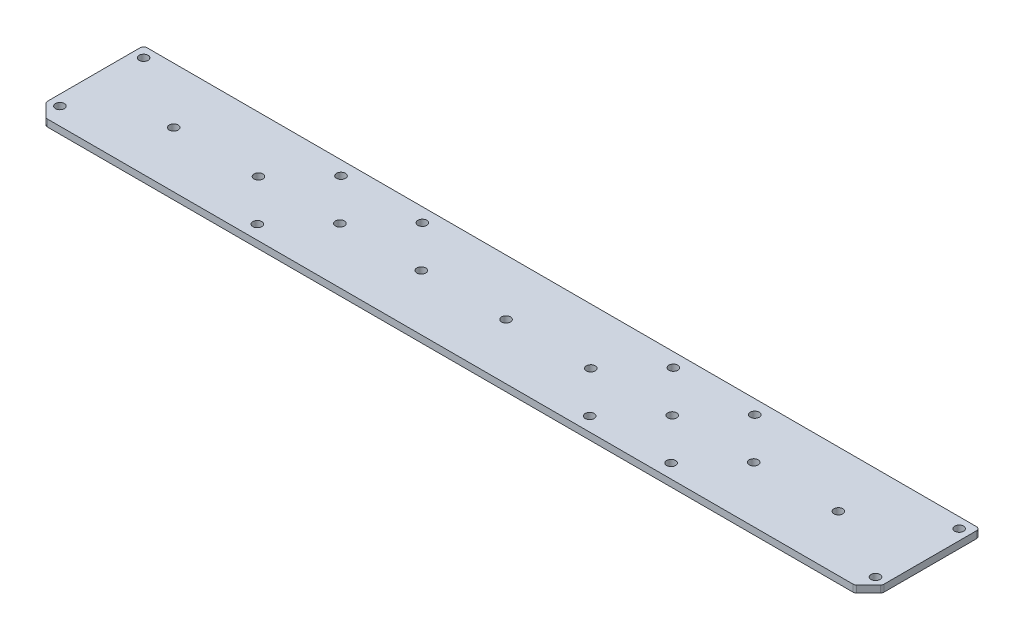
from build123d import *

# Parameters (mm, degrees)
BOSS_EXTRUDE1_DEPTH = 3.175
SKETCH3_R           = 2.032
CUT_EXTRUDE1_DEPTH  = 385.384860036
FILLET1_R           = 1.5875


with BuildPart() as part:
    # Sketch2 → Boss-Extrude1 (new body)
    with BuildSketch(Plane(origin=(0, 0, 0), x_dir=(1, 0, 0), z_dir=(0, 1, 0))):
        with BuildLine():
            Line((0, 7.00756403), (0, 50.8))
            Line((0, 50.8), (381, 50.8))
            Line((381, 50.8), (381, 7.00756403))
            ThreePointArc((381, 7.00756403), (380.879158758, 6.400054081), (380.535032015, 5.885032015))
            Line((380.535032015, 5.885032015), (375.114967985, 0.464967985))
            ThreePointArc((375.114967985, 0.464967985), (374.599945919, 0.120841242), (373.99243597, 0))
            Line((373.99243597, 0), (7.00756403, 0))
            ThreePointArc((7.00756403, 0), (6.400054081, 0.120841242), (5.885032015, 0.464967985))
            Line((5.885032015, 0.464967985), (0.464967985, 5.885032015))
            ThreePointArc((0.464967985, 5.885032015), (0.120841242, 6.400054081), (0, 7.00756403))
        make_face()
    extrude(amount=BOSS_EXTRUDE1_DEPTH)

    # Sketch3 → Cut-Extrude1 (cut, through all)
    with BuildSketch(Plane(origin=(0, 0, 0), x_dir=(1, 0, 0), z_dir=(0, 1, 0))):
        with Locations(Location((4.7625, 7.9375, 0), (0, 0, 270))):
            Circle(SKETCH3_R)
        with Locations(Location((4.7625, 46.0375, 0), (0, 0, 270))):
            Circle(SKETCH3_R)
        with Locations(Location((376.2375, 7.9375, 0), (0, 0, 270))):
            Circle(SKETCH3_R)
        with Locations(Location((376.2375, 46.0375, 0), (0, 0, 270))):
            Circle(SKETCH3_R)
        with Locations(Location((341.884, 25.4, 0), (0, 0, 270))):
            Circle(SKETCH3_R)
        with Locations(Location((247.65, 44.45, 0), (0, 0, 270))):
            Circle(SKETCH3_R)
        with Locations(Location((284.734, 44.45, 0), (0, 0, 270))):
            Circle(SKETCH3_R)
        with Locations(Location((247.65, 6.35, 0), (0, 0, 270))):
            Circle(SKETCH3_R)
        with Locations(Location((284.734, 6.35, 0), (0, 0, 270))):
            Circle(SKETCH3_R)
        with Locations(Location((190.5, 25.4, 0), (0, 0, 270))):
            Circle(SKETCH3_R)
        with Locations(Location((133.35, 44.45, 0), (0, 0, 270))):
            Circle(SKETCH3_R)
        with Locations(Location((96.266, 44.45, 0), (0, 0, 270))):
            Circle(SKETCH3_R)
        with Locations(Location((96.266, 6.35, 0), (0, 0, 270))):
            Circle(SKETCH3_R)
        with Locations(Location((77.724, 25.4, 0), (0, 0, 270))):
            Circle(SKETCH3_R)
        with Locations(Location((39.116, 25.4, 0), (0, 0, 270))):
            Circle(SKETCH3_R)
        with Locations(Location((151.892, 25.4, 0), (0, 0, 270))):
            Circle(SKETCH3_R)
        with Locations(Location((229.108, 25.4, 0), (0, 0, 270))):
            Circle(SKETCH3_R)
        with Locations(Location((266.192, 25.4, 0), (0, 0, 270))):
            Circle(SKETCH3_R)
        with Locations(Location((303.276, 25.4, 0), (0, 0, 270))):
            Circle(SKETCH3_R)
        with Locations(Location((114.808, 25.4, 0), (0, 0, 270))):
            Circle(SKETCH3_R)
    extrude(amount=CUT_EXTRUDE1_DEPTH, mode=Mode.SUBTRACT)

    # Fillet1
    fillet1_edges = [part.edges().sort_by_distance(p)[0] for p in [
        (381, 1.5875, -50.8),
        (0, 1.5875, -50.8),
    ]]
    fillet(fillet1_edges, radius=FILLET1_R)


solid = part.part
